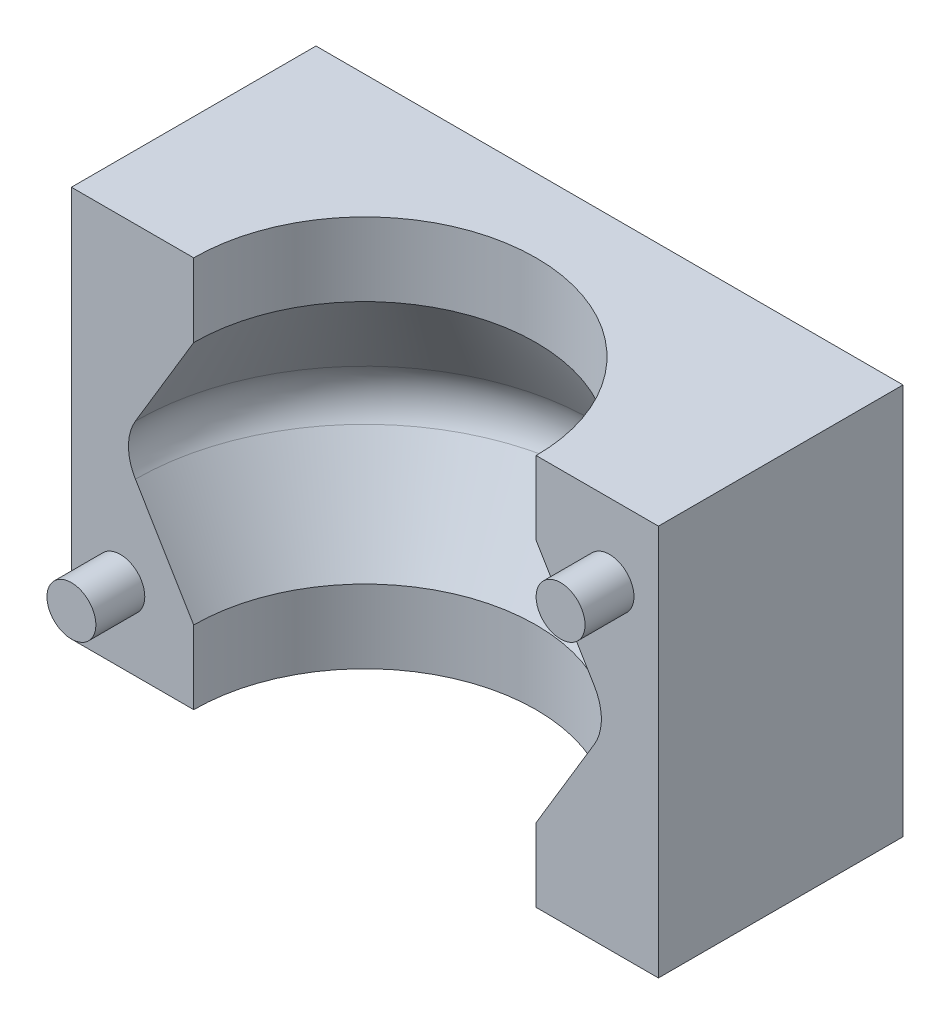
from build123d import *

# Parameters (mm, degrees)
SKETCH1_W           = 120
SKETCH1_H           = 80
BOSS_EXTRUDE1_DEPTH = 50
SKETCH3_R           = 5
BOSS_EXTRUDE2_DEPTH = 10


with BuildPart() as part:
    # Sketch1 → Boss-Extrude1 (new body)
    with BuildSketch(Plane.XY):
        Rectangle(SKETCH1_W, SKETCH1_H)
    extrude(amount=BOSS_EXTRUDE1_DEPTH)

    # Sketch3 → Boss-Extrude2 (add)
    with BuildSketch(Plane.XY.offset(50)):
        with Locations((50, 25)):
            Circle(SKETCH3_R)
        with Locations((-50, -25)):
            Circle(SKETCH3_R)
    extrude(amount=BOSS_EXTRUDE2_DEPTH)

    # Sketch2 → Cut-Revolve2 (revolve, cut)
    with BuildSketch(Plane.XY.offset(50)):
        with BuildLine():
            Line((-35, 40), (-35, 25))
            Line((-35, 25), (-46.913025467, 5.144957554))
            ThreePointArc((-46.913025467, 5.144957554), (-48.33809621, 0), (-46.913025467, -5.144957554))
            Line((-46.913025467, -5.144957554), (-35, -25))
            Line((-35, -25), (-35, -40))
            Line((-35, -40), (0, -40))
            Line((0, -40), (0, 40))
            Line((0, 40), (-35, 40))
        make_face()
    revolve(axis=Axis((0, 43.927138889, 50), (0, -1, 0)), mode=Mode.SUBTRACT)


solid = part.part
